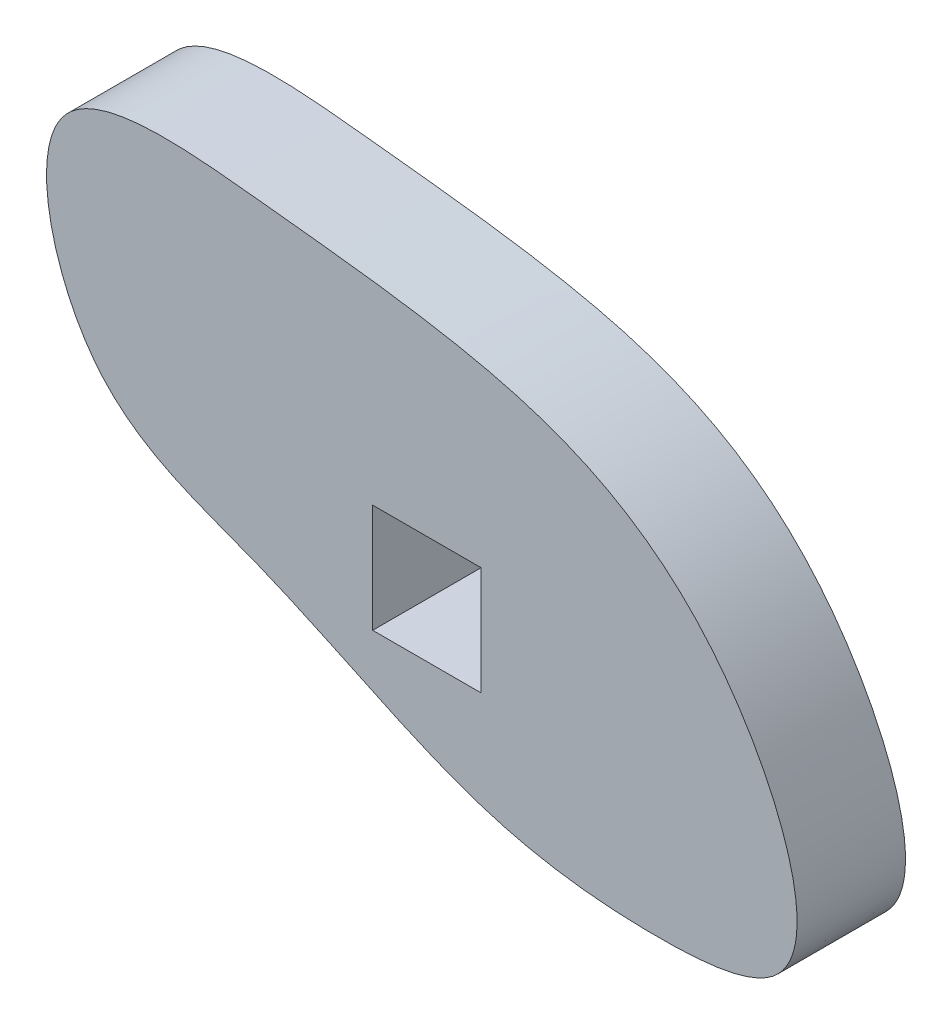
from build123d import *

# Parameters (mm, degrees)
SKETCH1_W           = 1.524
SKETCH1_H           = 1.524
BOSS_EXTRUDE1_DEPTH = 1.524


with BuildPart() as part:
    # Sketch1 → Boss-Extrude1 (new body)
    with BuildSketch(Plane.XY):
        with BuildLine():
            add(Edge.make_bspline(
                [(7.788210834, 59.637377536), (8.552428619, 59.392019525), (9.87105853, 59.206525155), (12.993309012, 59.429050375), (11.145278004, 64.095820828), (7.76826039, 65.120861798), (4.810343538, 65.425230024), (1.108944301, 65.8389715), (2.042949609, 61.815529916), (4.953229398, 61.021597327), (6.729033119, 59.977434705), (7.788210834, 59.637377536)],
                knots=[0, 0, 0, 0, 0.094464638, 0.15866288, 0.295651603, 0.457810616, 0.557025317, 0.663282087, 0.771859744, 0.86907549, 1, 1, 1, 1], degree=3))
        make_face()
        with Locations((7.026210834, 61.771154306)):
            Rectangle(SKETCH1_W, SKETCH1_H, mode=Mode.SUBTRACT)
    extrude(amount=BOSS_EXTRUDE1_DEPTH)


solid = part.part
